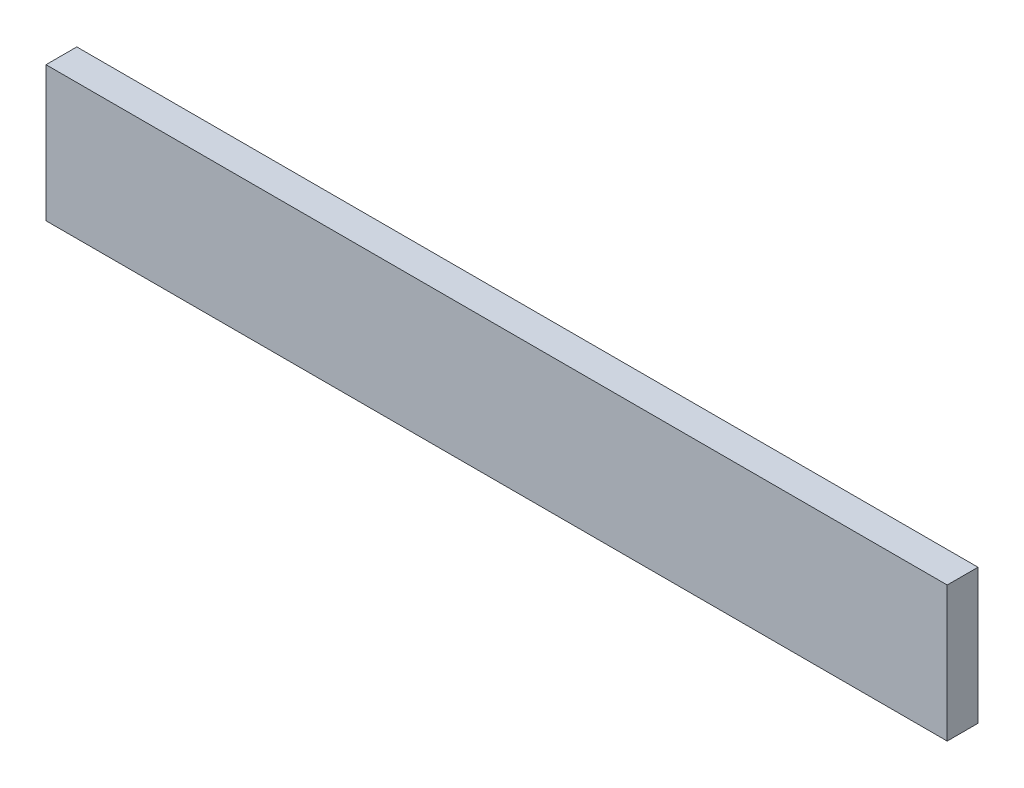
from build123d import *

# Parameters (mm, degrees)
SKETCH1_W           = 600
SKETCH1_H           = 90
BOSS_EXTRUDE1_DEPTH = 20.5


with BuildPart() as part:
    # Sketch1 → Boss-Extrude1 (new body)
    with BuildSketch(Plane.XY):
        with Locations((0, 45)):
            Rectangle(SKETCH1_W, SKETCH1_H)
    extrude(amount=BOSS_EXTRUDE1_DEPTH)


solid = part.part
